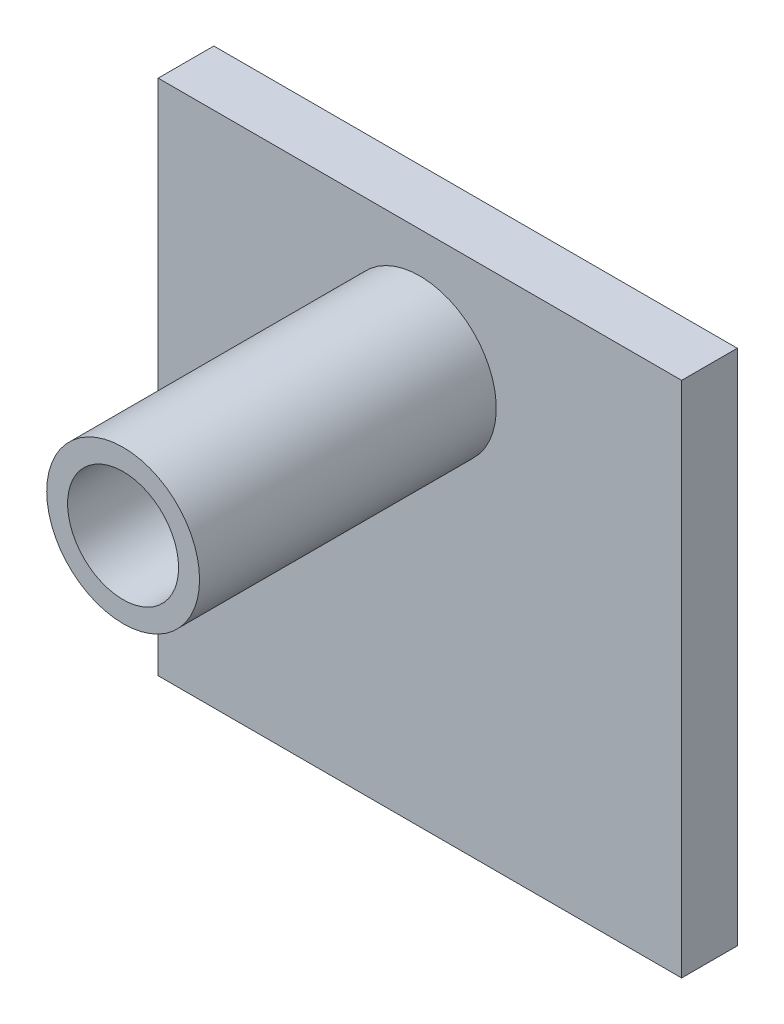
from build123d import *

# Parameters (mm, degrees)
SKETCH_1_W          = 56.451666402
SKETCH_1_H          = 55.81933344
SKETCH_1_R          = 6.008227446
EXTRUDE_1_DEPTH     = 6
SKETCH_2_R          = 5.984064553
EXTRUDE_2_DEPTH     = 32
SKETCH_3_R          = 8.240525962
EXTRUDE_3_DEPTH     = 32
SKETCH_2_3_R        = 5.984064553
CUT_EXTRUDE_2_DEPTH = 51.986735101


with BuildPart() as part:
    # 草图1 → 凸台-拉伸1 (new body)
    with BuildSketch(Plane.XY):
        Rectangle(SKETCH_1_W, SKETCH_1_H)
        with Locations((0, 15.26895552)):
            Circle(SKETCH_1_R, mode=Mode.SUBTRACT)
    extrude(amount=EXTRUDE_1_DEPTH)



with BuildPart() as body_2:
    # 草图2 → 凸台-拉伸2 (new body)
    with BuildSketch(Plane.XY.offset(6)):
        with Locations((-0.012037356, 15.289906593)):
            Circle(SKETCH_2_R)
    extrude(amount=EXTRUDE_2_DEPTH)


with BuildPart() as part_1:
    add(part.part)

    add(body_2.part)  # 凸台-拉伸3 merges body 2
    # 草图3 → 凸台-拉伸3 (add)
    with BuildSketch(Plane.XY.offset(6)):
        with Locations((-0.006651179, 15.303273522)):
            Circle(SKETCH_3_R)
    extrude(amount=EXTRUDE_3_DEPTH)

    # 草图2<3> → 切除-拉伸2 (cut, through all)
    with BuildSketch(Plane.XY.offset(6)):
        with Locations((-0.012037356, 15.289906593)):
            Circle(SKETCH_2_3_R)
    extrude(amount=CUT_EXTRUDE_2_DEPTH, mode=Mode.SUBTRACT)


solid = part_1.part
